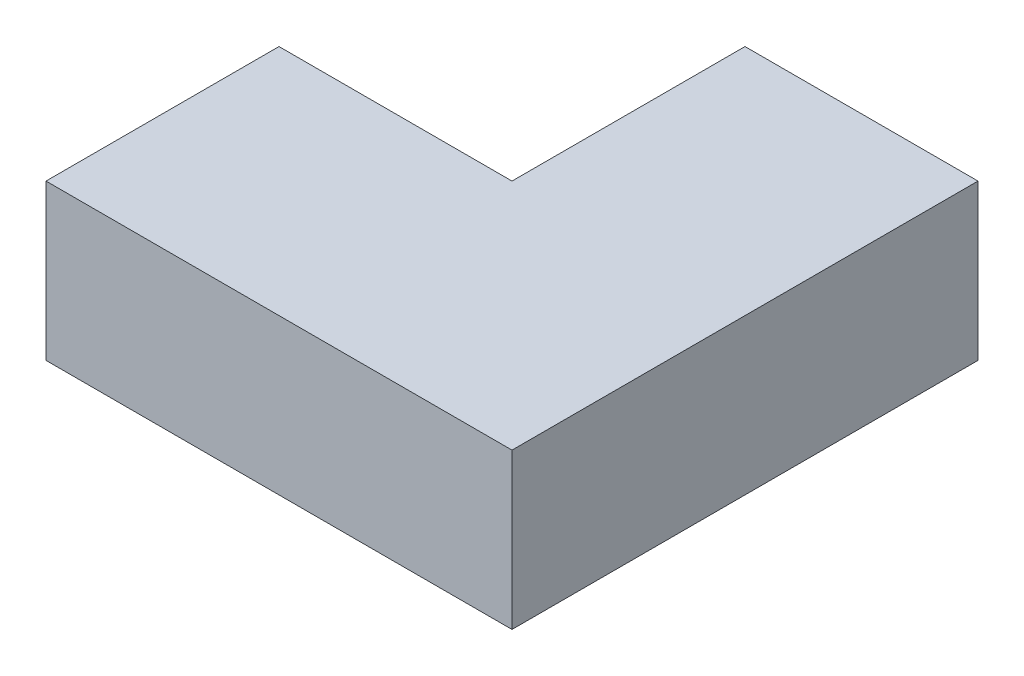
from build123d import *

# Parameters (mm, degrees)
SALIENTE_EXTRUIR1_DEPTH = 0.5
SALIENTE_EXTRUIR2_DEPTH = 3


with BuildPart() as part:
    # Croquis1 → Saliente-Extruir1 (new body)
    with BuildSketch(Plane(origin=(0, 0, 0), x_dir=(1, 0, 0), z_dir=(0, 1, 0))):
        Polygon((0, 0), (0, 2.5), (4.5, 2.5), (4.5, 7), (7, 7), (7, 0), align=None)
    extrude(amount=SALIENTE_EXTRUIR1_DEPTH)

    # Croquis2 → Saliente-Extruir2 (add)
    with BuildSketch(Plane(origin=(0, 0.5, 0), x_dir=(1, 0, 0), z_dir=(0, 1, 0))):
        Polygon((0, 2.5), (0, 0), (0, -2), (9, -2), (9, 7), (7, 7), (4.5, 7), (4.5, 2.5), align=None)
    extrude(amount=SALIENTE_EXTRUIR2_DEPTH)


solid = part.part
